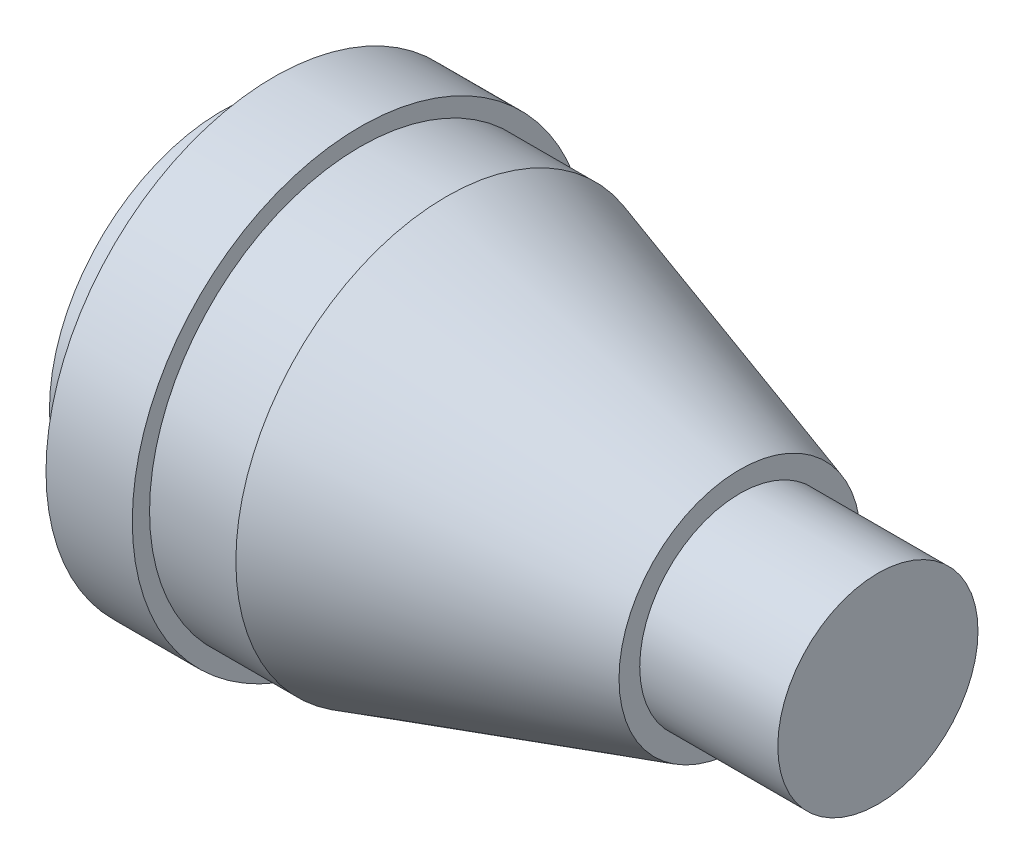
from build123d import *


with BuildPart() as part:
    # 草图1 → 旋转1 (revolve)
    with BuildSketch(Plane.XY, mode=Mode.PRIVATE) as revolve_1_sk:
        Polygon((0, 0), (0, 10), (3, 10), (3, 13.2), (8, 13.2), (8, 12.2), (13, 12.2), (30, 7), (30, 5.8), (38, 5.8), (38, 0), align=None)
    revolve(revolve_1_sk.sketch.rotate(Axis((0, 0, 0), (1, 0, 0)), 90), axis=Axis((0, 0, 0), (1, 0, 0)))


solid = part.part
